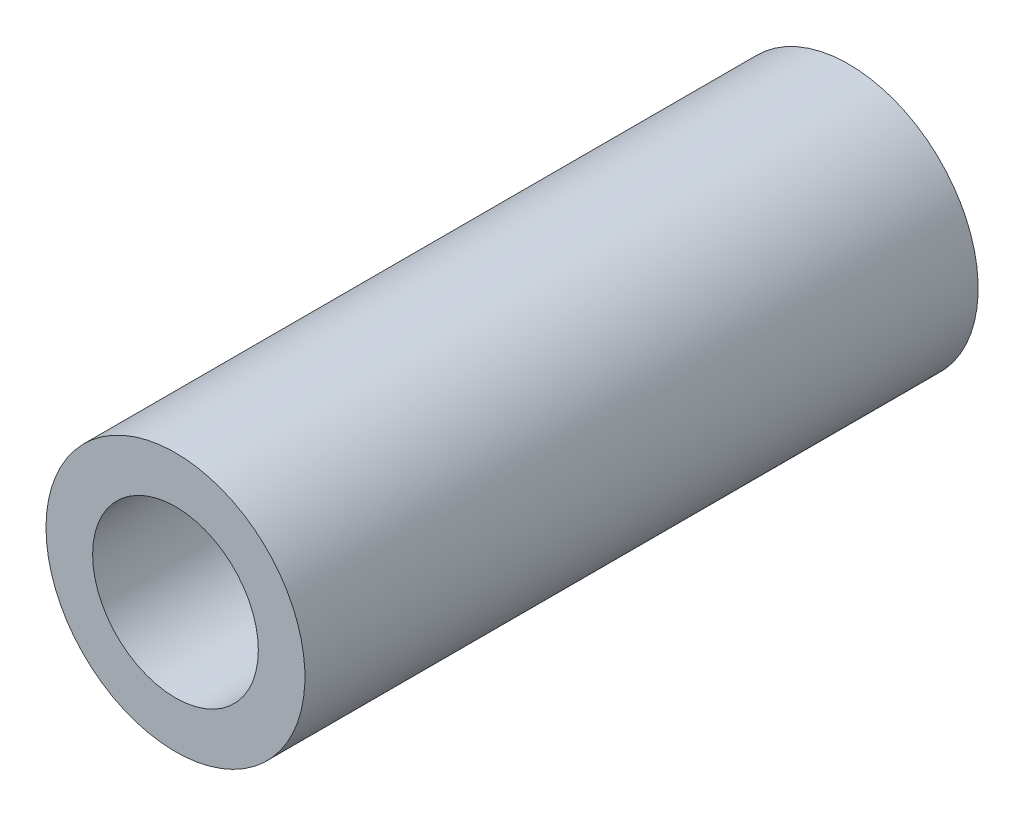
from build123d import *

# Parameters (mm, degrees)
SKETCH1_R           = 2.5
SKETCH1_R_2         = 1.6
BOSS_EXTRUDE1_DEPTH = 13


with BuildPart() as part:
    # Sketch1 → Boss-Extrude1 (new body)
    with BuildSketch(Plane.XY):
        with Locations(Location((0, 0, 0), (0, 0, 180))):
            Circle(SKETCH1_R)
        with Locations(Location((0, 0, 0), (0, 0, 180))):
            Circle(SKETCH1_R_2, mode=Mode.SUBTRACT)
    extrude(amount=BOSS_EXTRUDE1_DEPTH)


solid = part.part
